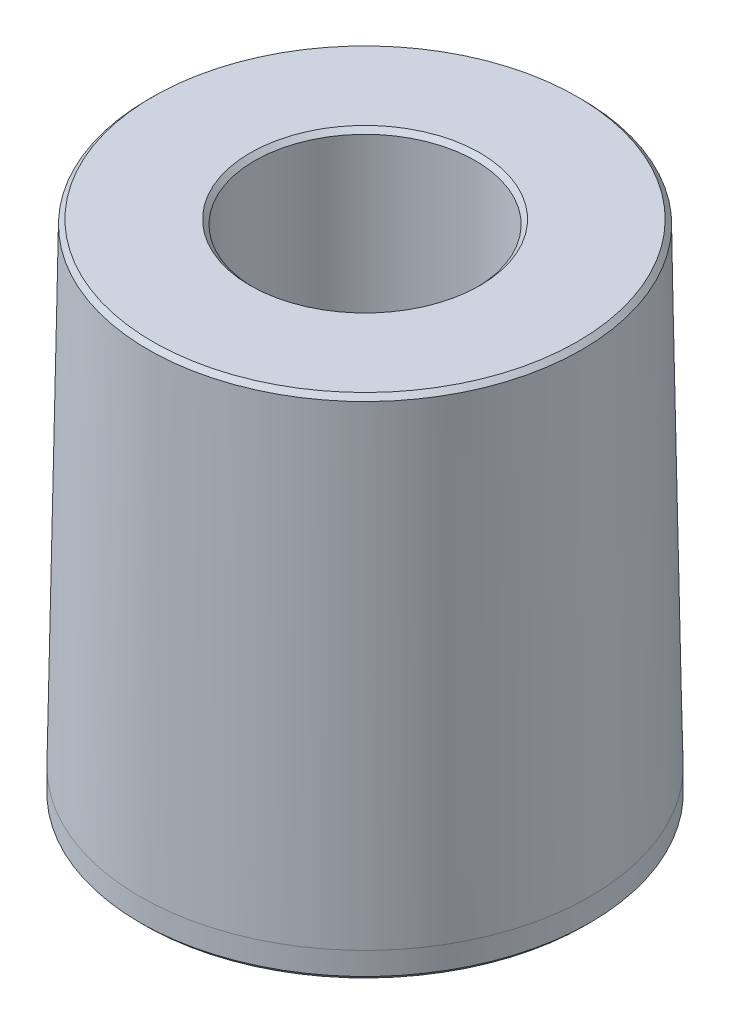
from build123d import *
from OCP.BRepFilletAPI import BRepFilletAPI_MakeChamfer

# Parameters (mm, degrees)
SFAZOWANIE1_SIZE  = 1
SFAZOWANIE1_SIZE2 = 1.017920191


with BuildPart() as part:
    # Szkic1 → Obrót1 (revolve)
    with BuildSketch(Plane.XY, mode=Mode.PRIVATE) as obr_t1_sk:
        with BuildLine():
            Line((-24.45, 14.960440746), (-24.45, 104.960440746))
            Line((-24.45, 104.960440746), (-48, 104.960440746))
            Line((-48, 104.960440746), (-49.832781817, -0.039559254))
            Line((-49.832781817, -0.039559254), (-49.832781817, -6.039559254))
            Line((-49.832781817, -6.039559254), (-23.45, -6.039559254))
            Line((-23.45, -6.039559254), (-23.45, 13.960440746))
            ThreePointArc((-23.45, 13.960440746), (-24.157106781, 14.253333965), (-24.45, 14.960440746))
        make_face()
    revolve(obr_t1_sk.sketch.rotate(Axis((0, 0, 0), (0, 1, 0)), 180), axis=Axis((0, 0, 0), (0, 1, 0)))

    # Sfazowanie1: one chamfer whose edges measure the first distance from different faces: ONE call of the kernel's chamfer builder (chamfer() names one face for all edges)
    sfazowanie1_edges_1 = [part.edges().sort_by_distance(p)[0] for p in [
        (-24.45, 104.960440746, 0),
        (-23.45, -6.039559254, 0),
        (-49.832781817, -6.039559254, 0),
    ]]
    sfazowanie1_edges_2 = [part.edges().sort_by_distance(p)[0] for p in [
        (-48, 104.960440746, 0),
    ]]
    sfazowanie1_side_2 = [part.faces().sort_by_distance(p)[0] for p in [
        (-25.80764502, 104.960440746, 0),
    ]]
    sfazowanie1 = BRepFilletAPI_MakeChamfer(part.part.solid().wrapped)
    for e in sfazowanie1_edges_1:
        sfazowanie1.Add(SFAZOWANIE1_SIZE, e.wrapped)
    for e in sfazowanie1_edges_2:
        sfazowanie1.Add(SFAZOWANIE1_SIZE, SFAZOWANIE1_SIZE2, e.wrapped, sfazowanie1_side_2[0].wrapped)  # the first distance lies on this face
    add(Compound.cast(sfazowanie1.Shape()), mode=Mode.REPLACE)


solid = part.part
